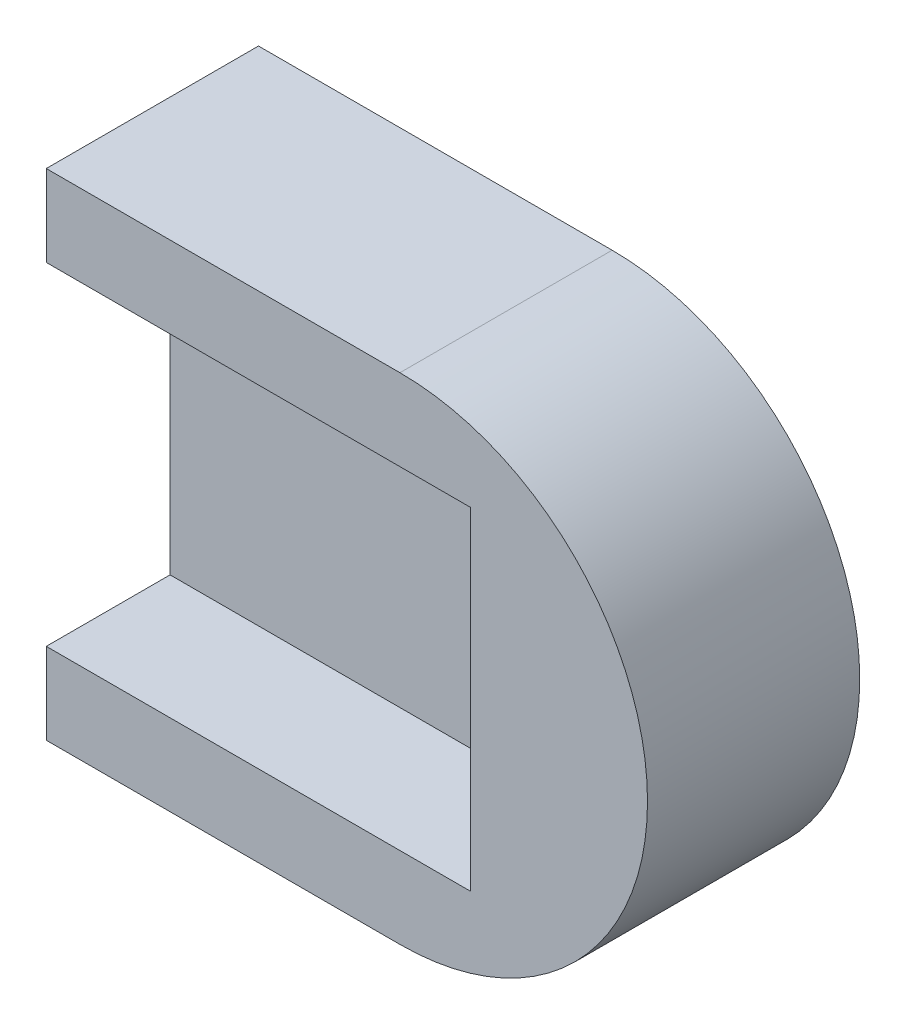
from build123d import *

# Parameters (mm, degrees)
EXTRUDE_1_DEPTH     = 60
SKETCH_2_W          = 120
SKETCH_2_H          = 94
CUT_EXTRUDE_1_DEPTH = 35
SKETCH_3_R          = 20
CUT_EXTRUDE_2_DEPTH = 15


with BuildPart() as part:
    # ｽｹｯﾁ1 → ﾎﾞｽ - 押し出し1 (new body)
    with BuildSketch(Plane.XY):
        with BuildLine():
            Line((-50, 70), (50, 70))
            ThreePointArc((50, 70), (120, 0), (50, -70))
            Line((50, -70), (-50, -70))
            Line((-50, -70), (-50, 70))
        make_face()
    extrude(amount=EXTRUDE_1_DEPTH)

    # ｽｹｯﾁ2 → ｶｯﾄ - 押し出し1 (cut)
    with BuildSketch(Plane.XY.offset(60)):
        with Locations((10, 0)):
            Rectangle(SKETCH_2_W, SKETCH_2_H)
    extrude(amount=-CUT_EXTRUDE_1_DEPTH, mode=Mode.SUBTRACT)

    # ｽｹｯﾁ3 → ｶｯﾄ - 押し出し2 (cut)
    with BuildSketch(Plane(origin=(0, 0, 0), x_dir=(-1, 0, 0), z_dir=(0, 0, -1))):
        with Locations((-30, 0)):
            Circle(SKETCH_3_R)
    extrude(amount=-CUT_EXTRUDE_2_DEPTH, mode=Mode.SUBTRACT)


solid = part.part
